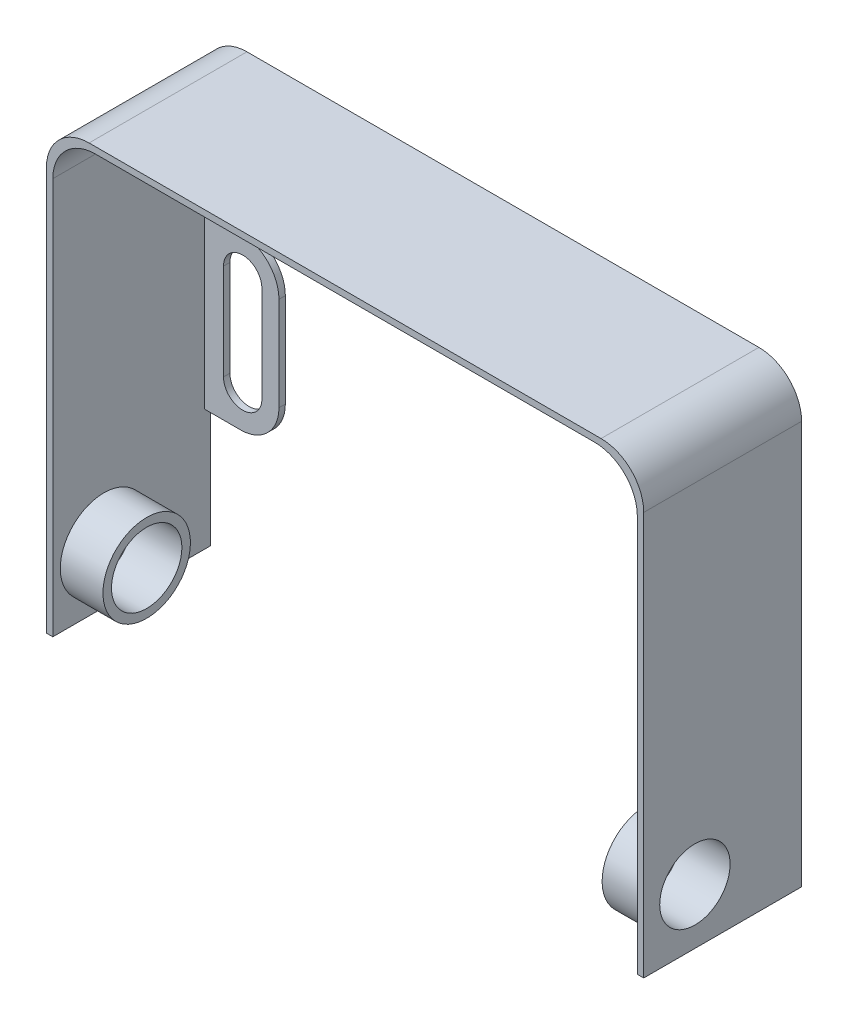
from build123d import *

# Parameters (mm, degrees)
SKIZZE1_W                            = 140
SKIZZE1_H                            = 209.01
SKIZZE1_W_2                          = 137
SKIZZE1_H_2                          = 206.01
AUFSATZ_LINEAR_AUSTRAGEN1_DEPTH      = 37
VERRUNDUNG1_R                        = 10
SCHNITT_LINEAR_AUSTRAGEN2_DEPTH      = 255.27186258
SCHNITT_LINEAR_AUSTRAGEN2_DEPTH_BACK = 255.27186258
SKIZZE4_R                            = 8.25
AUFSATZ_LINEAR_AUSTRAGEN3_DEPTH      = 1.5
SCHNITT_LINEAR_AUSTRAGEN3_DEPTH      = 255.057926662
SCHNITT_LINEAR_AUSTRAGEN3_DEPTH_BACK = 255.057926662
SKIZZE6_W                            = 230.516002865
SKIZZE6_H                            = 119.565202556
AUFSATZ_LINEAR_START                 = 10
SKIZZE8_R                            = 10.25
SKIZZE8_R_2                          = 8.25
AUFSATZ_LINEAR_AUSTRAGEN5_DEPTH      = 10


with BuildPart() as part:
    # Skizze1 → Aufsatz-Linear austragen1 (new body)
    with BuildSketch(Plane.XY):
        with Locations((70, 104.505)):
            Rectangle(SKIZZE1_W, SKIZZE1_H)
        with Locations((70, 104.505)):
            Rectangle(SKIZZE1_W_2, SKIZZE1_H_2, mode=Mode.SUBTRACT)
    extrude(amount=AUFSATZ_LINEAR_AUSTRAGEN1_DEPTH)

    # Verrundung1
    verrundung1_edges = [part.edges().sort_by_distance(p)[0] for p in [
        (1.5, 207.51, 18.5),
        (1.5, 1.5, 18.5),
        (138.5, 1.5, 18.5),
        (138.5, 207.51, 18.5),
        (0, 209.01, 18.5),
        (140, 209.01, 18.5),
        (140, 0, 18.5),
        (0, 0, 18.5),
    ]]
    fillet(verrundung1_edges, radius=VERRUNDUNG1_R)

    # Skizze4 → Schnitt-Linear austragen2 (cut, two sides: drawn at the far end of the back side and taken through both)
    with BuildSketch(Plane(origin=(140, 0, 0), x_dir=(0, 0, -1), z_dir=(1, 0, 0)).offset(-SCHNITT_LINEAR_AUSTRAGEN2_DEPTH_BACK)):
        with Locations(Location((-25, 117.505, 0), (0, 0, 270))):
            Circle(SKIZZE4_R)
        with Locations(Location((-25, 91.505, 0), (0, 0, 270))):
            Circle(SKIZZE4_R)
    extrude(amount=SCHNITT_LINEAR_AUSTRAGEN2_DEPTH + SCHNITT_LINEAR_AUSTRAGEN2_DEPTH_BACK, mode=Mode.SUBTRACT)

    # Skizze5 → Aufsatz-Linear austragen3 (add)
    # profile 1 of 5: a face of its own
    with BuildSketch(Plane(origin=(0, 0, 0), x_dir=(-1, 0, 0), z_dir=(0, 0, -1))):
        with BuildLine():
            Line((-140, 173.01), (-130, 173.01))
            ThreePointArc((-130, 173.01), (-123.636038969, 170.373961031), (-121, 164.01))
            Line((-121, 164.01), (-121, 142.01))
            ThreePointArc((-121, 142.01), (-123.636038969, 135.646038969), (-130, 133.01))
            Line((-130, 133.01), (-140, 133.01))
            Line((-140, 133.01), (-140, 173.01))
        make_face()
        with BuildLine():
            Line((-125, 164.26), (-125, 141.76))
            ThreePointArc((-125, 141.76), (-129.5, 137.26), (-134, 141.76))
            Line((-134, 141.76), (-134, 164.26))
            ThreePointArc((-134, 164.26), (-129.5, 168.76), (-125, 164.26))
        make_face(mode=Mode.SUBTRACT)
    # profile 2 of 5: a face of its own
    with BuildSketch(Plane(origin=(0, 0, 0), x_dir=(-1, 0, 0), z_dir=(0, 0, -1))):
        with BuildLine():
            Line((-90, 209.01), (-90, 200.82))
            ThreePointArc((-90, 200.82), (-87.363961031, 194.456038969), (-81, 191.82))
            Line((-81, 191.82), (-59, 191.82))
            ThreePointArc((-59, 191.82), (-52.636038969, 194.456038969), (-50, 200.82))
            Line((-50, 200.82), (-50, 209.01))
            Line((-50, 209.01), (-90, 209.01))
        make_face()
        with BuildLine():
            Line((-58.75, 204.82), (-81.25, 204.82))
            ThreePointArc((-81.25, 204.82), (-85.75, 200.32), (-81.25, 195.82))
            Line((-81.25, 195.82), (-58.75, 195.82))
            ThreePointArc((-58.75, 195.82), (-54.25, 200.32), (-58.75, 204.82))
        make_face(mode=Mode.SUBTRACT)
    # profile 3 of 5: a face of its own
    with BuildSketch(Plane(origin=(0, 0, 0), x_dir=(-1, 0, 0), z_dir=(0, 0, -1))):
        with BuildLine():
            Line((-19, 164.01), (-19, 142.01))
            ThreePointArc((-19, 142.01), (-16.363961031, 135.646038969), (-10, 133.01))
            Line((-10, 133.01), (0, 133.01))
            Line((0, 133.01), (0, 173.01))
            Line((0, 173.01), (-10, 173.01))
            ThreePointArc((-10, 173.01), (-16.363961031, 170.373961031), (-19, 164.01))
        make_face()
        with BuildLine():
            Line((-15, 164.26), (-15, 141.76))
            ThreePointArc((-15, 141.76), (-10.5, 137.26), (-6, 141.76))
            Line((-6, 141.76), (-6, 164.26))
            ThreePointArc((-6, 164.26), (-10.5, 168.76), (-15, 164.26))
        make_face(mode=Mode.SUBTRACT)
    # profile 4 of 5: a face of its own
    with BuildSketch(Plane(origin=(0, 0, 0), x_dir=(-1, 0, 0), z_dir=(0, 0, -1))):
        with BuildLine():
            Line((0, 36), (-10, 36))
            ThreePointArc((-10, 36), (-16.363961031, 38.636038969), (-19, 45))
            Line((-19, 45), (-19, 67))
            ThreePointArc((-19, 67), (-16.363961031, 73.363961031), (-10, 76))
            Line((-10, 76), (0, 76))
            Line((0, 76), (0, 36))
        make_face()
        with BuildLine():
            Line((-15, 44.75), (-15, 67.25))
            ThreePointArc((-15, 67.25), (-10.5, 71.75), (-6, 67.25))
            Line((-6, 67.25), (-6, 44.75))
            ThreePointArc((-6, 44.75), (-10.5, 40.25), (-15, 44.75))
        make_face(mode=Mode.SUBTRACT)
    # profile 5 of 5: a face of its own
    with BuildSketch(Plane(origin=(0, 0, 0), x_dir=(-1, 0, 0), z_dir=(0, 0, -1))):
        with BuildLine():
            Line((-121, 45), (-121, 67))
            ThreePointArc((-121, 67), (-123.636038969, 73.363961031), (-130, 76))
            Line((-130, 76), (-140, 76))
            Line((-140, 76), (-140, 36))
            Line((-140, 36), (-130, 36))
            ThreePointArc((-130, 36), (-123.636038969, 38.636038969), (-121, 45))
        make_face()
        with BuildLine():
            Line((-125, 44.75), (-125, 67.25))
            ThreePointArc((-125, 67.25), (-129.5, 71.75), (-134, 67.25))
            Line((-134, 67.25), (-134, 44.75))
            ThreePointArc((-134, 44.75), (-129.5, 40.25), (-125, 44.75))
        make_face(mode=Mode.SUBTRACT)
    extrude(amount=-AUFSATZ_LINEAR_AUSTRAGEN3_DEPTH)

    # Skizze6 → Schnitt-Linear austragen3 (cut, two sides: drawn at the far end of the back side and taken through both)
    with BuildSketch(Plane.XY.offset(1.5).offset(-SCHNITT_LINEAR_AUSTRAGEN3_DEPTH_BACK)):
        with Locations((84.29357918, 44.722398722)):
            Rectangle(SKIZZE6_W, SKIZZE6_H)
    extrude(amount=SCHNITT_LINEAR_AUSTRAGEN3_DEPTH + SCHNITT_LINEAR_AUSTRAGEN3_DEPTH_BACK, mode=Mode.SUBTRACT)

    # Skizze8 → Aufsatz-Linear austragen5 (add)
    with BuildSketch(Plane(origin=(1.5, 0, 0), x_dir=(0, 0, -1), z_dir=(1, 0, 0)).offset(AUFSATZ_LINEAR_START)):
        with Locations(Location((-25, 117.505, 0), (0, 0, 90))):
            Circle(SKIZZE8_R)
        with Locations(Location((-25, 117.505, 0), (0, 0, 270))):
            Circle(SKIZZE8_R_2, mode=Mode.SUBTRACT)
    aufsatz_linear_austragen5 = extrude(amount=-AUFSATZ_LINEAR_AUSTRAGEN5_DEPTH)

    # Spiegeln1: Aufsatz-Linear austragen5 across plane
    add(aufsatz_linear_austragen5.mirror(Plane.ZY.offset(-70)))


solid = part.part
